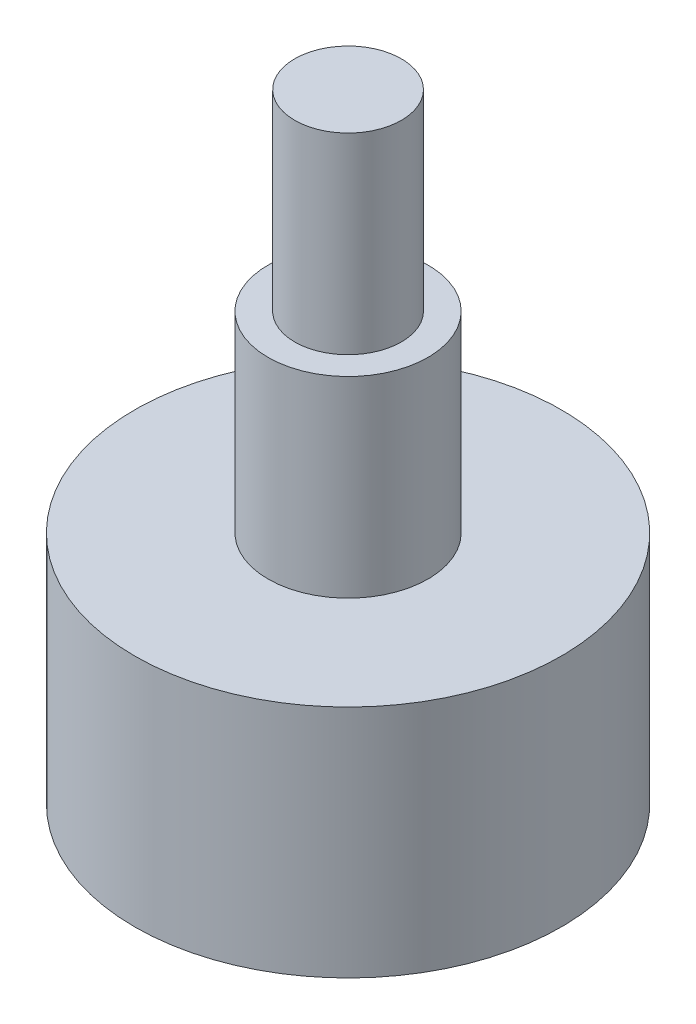
from build123d import *

# Parameters (mm, degrees)
SKETCH1_R           = 12.7
BOSS_EXTRUDE1_DEPTH = 13.97
SKETCH2_R           = 4.7625
BOSS_EXTRUDE2_DEPTH = 11.43
SKETCH3_R           = 3.175
BOSS_EXTRUDE3_DEPTH = 11.43


with BuildPart() as part:
    # Sketch1 → Boss-Extrude1 (new body)
    with BuildSketch(Plane(origin=(0, 0, 0), x_dir=(1, 0, 0), z_dir=(0, 1, 0))):
        with Locations(Location((0, 0, 0), (0, 0, 270))):
            Circle(SKETCH1_R)
    extrude(amount=BOSS_EXTRUDE1_DEPTH)

    # Sketch2 → Boss-Extrude2 (add)
    with BuildSketch(Plane(origin=(0, 13.97, 0), x_dir=(1, 0, 0), z_dir=(0, 1, 0))):
        with Locations(Location((0, 0, 0), (0, 0, 270))):
            Circle(SKETCH2_R)
    extrude(amount=BOSS_EXTRUDE2_DEPTH)

    # Sketch3 → Boss-Extrude3 (add)
    with BuildSketch(Plane(origin=(0, 25.4, 0), x_dir=(1, 0, 0), z_dir=(0, 1, 0))):
        with Locations(Location((0, 0, 0), (0, 0, 270))):
            Circle(SKETCH3_R)
    extrude(amount=BOSS_EXTRUDE3_DEPTH)


solid = part.part
